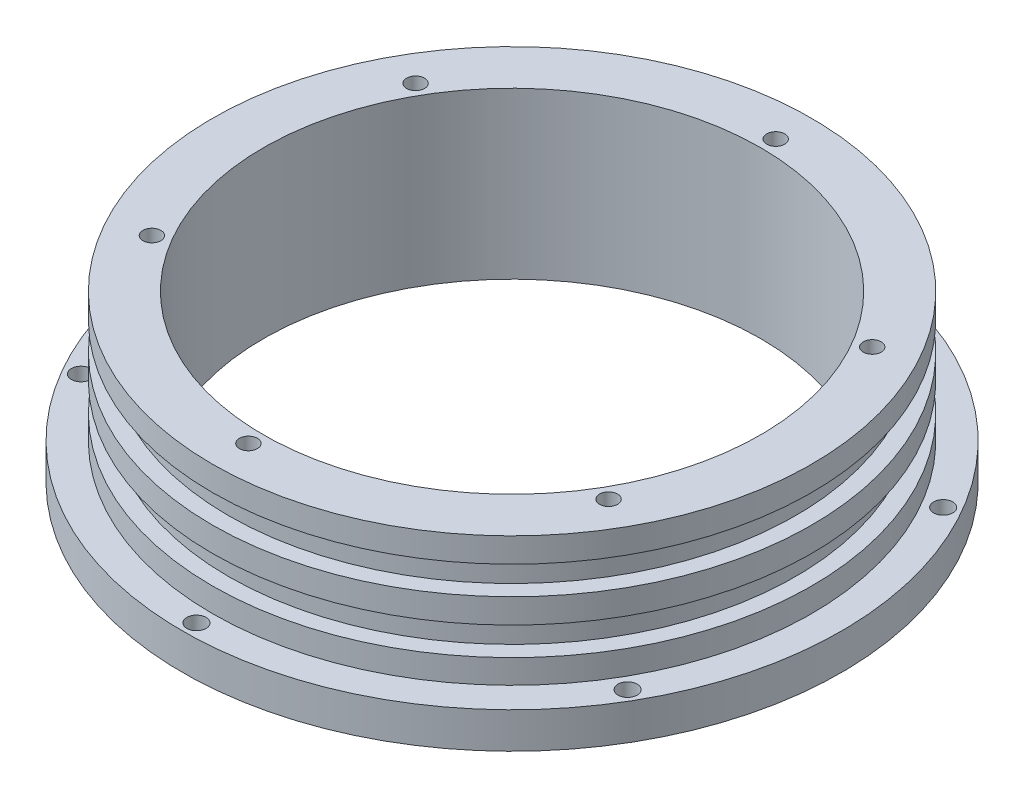
from build123d import *

# Parameters (mm, degrees)
SKETCH_1_R          = 55
SKETCH_1_R_2        = 41.5
EXTRUDE_1_DEPTH     = 27.6
CUT_EXTRUDE_START   = -21.6
SKETCH_2_R          = 55
SKETCH_2_R_2        = 50
CUT_EXTRUDE_1_DEPTH = 21.6
SKETCH_3_W          = 2.7
SKETCH_3_H          = 4.7
SKETCH_4_R          = 50
SKETCH_4_R_2        = 46
CUT_EXTRUDE_2_DEPTH = 2.7
SKETCH_5_R          = 1.6
CUT_EXTRUDE_3_DEPTH = 83.533387184
SKETCH_6_R          = 1.5
CUT_EXTRUDE_4_DEPTH = 6


with BuildPart() as part:
    # 草图1 → 凸台-拉伸1 (new body)
    with BuildSketch(Plane(origin=(0, 0, 0), x_dir=(1, 0, 0), z_dir=(0, 1, 0))):
        with Locations(Location((0, 0, 0), (0, 0, 90))):
            Circle(SKETCH_1_R)
        with Locations(Location((0, 0, 0), (0, 0, 90))):
            Circle(SKETCH_1_R_2, mode=Mode.SUBTRACT)
    extrude(amount=EXTRUDE_1_DEPTH)

    # 草图2 → 切除-拉伸1 (cut)
    with BuildSketch(Plane(origin=(0, 27.6, 0), x_dir=(1, 0, 0), z_dir=(0, 1, 0)).offset(CUT_EXTRUDE_START)):
        with Locations(Location((0, 0, 0), (0, 0, 90))):
            Circle(SKETCH_2_R)
        with Locations(Location((0, 0, 0), (0, 0, 270))):
            Circle(SKETCH_2_R_2, mode=Mode.SUBTRACT)
    extrude(amount=CUT_EXTRUDE_1_DEPTH, mode=Mode.SUBTRACT)

    # 草图3 → 切除-旋转1 (revolve, cut)
    with BuildSketch(Plane.XY, mode=Mode.PRIVATE) as cut_revolve_1_sk:
        with Locations((-48.65, 21.15)):
            Rectangle(SKETCH_3_W, SKETCH_3_H)
        with Locations((-48.65, 12.35)):
            Rectangle(SKETCH_3_W, SKETCH_3_H)
    revolve(cut_revolve_1_sk.sketch.rotate(Axis((0, 0, 0), (0, 1, 0)), 90), axis=Axis((0, 0, 0), (0, 1, 0)), mode=Mode.SUBTRACT)

    # 草图4 → 切除-拉伸2 (cut)
    with BuildSketch(Plane.XZ):
        with Locations(Location((0, 0, 0), (0, 0, 90))):
            Circle(SKETCH_4_R)
        with Locations(Location((0, 0, 0), (0, 0, 270))):
            Circle(SKETCH_4_R_2, mode=Mode.SUBTRACT)
    extrude(amount=-CUT_EXTRUDE_2_DEPTH, mode=Mode.SUBTRACT)

    # 草图5 → 切除-拉伸3 (cut, through all)
    with BuildSketch(Plane.XZ):
        with Locations(Location((45.612736373, 26.334525624, 0), (0, 0, 270))):
            Circle(SKETCH_5_R)
        with Locations(Location((45.612736373, -26.334525624, 0), (0, 0, 270))):
            Circle(SKETCH_5_R)
        with Locations(Location((0, -52.669051247, 0), (0, 0, 270))):
            Circle(SKETCH_5_R)
        with Locations(Location((-45.612736373, -26.334525624, 0), (0, 0, 270))):
            Circle(SKETCH_5_R)
        with Locations(Location((-45.612736373, 26.334525624, 0), (0, 0, 270))):
            Circle(SKETCH_5_R)
        with Locations(Location((0, 52.669051247, 0), (0, 0, 270))):
            Circle(SKETCH_5_R)
    extrude(amount=-CUT_EXTRUDE_3_DEPTH, mode=Mode.SUBTRACT)

    # 草图6 → 切除-拉伸4 (cut)
    with BuildSketch(Plane(origin=(0, 27.6, 0), x_dir=(1, 0, 0), z_dir=(0, 1, 0))):
        with Locations(Location((38.105117767, 22, 0), (0, 0, 270))):
            Circle(SKETCH_6_R)
        with Locations(Location((38.105117767, -22, 0), (0, 0, 270))):
            Circle(SKETCH_6_R)
        with Locations(Location((0, -44, 0), (0, 0, 270))):
            Circle(SKETCH_6_R)
        with Locations(Location((-38.105117767, -22, 0), (0, 0, 270))):
            Circle(SKETCH_6_R)
        with Locations(Location((-38.105117767, 22, 0), (0, 0, 270))):
            Circle(SKETCH_6_R)
        with Locations(Location((0, 44, 0), (0, 0, 270))):
            Circle(SKETCH_6_R)
    extrude(amount=-CUT_EXTRUDE_4_DEPTH, mode=Mode.SUBTRACT)


solid = part.part
